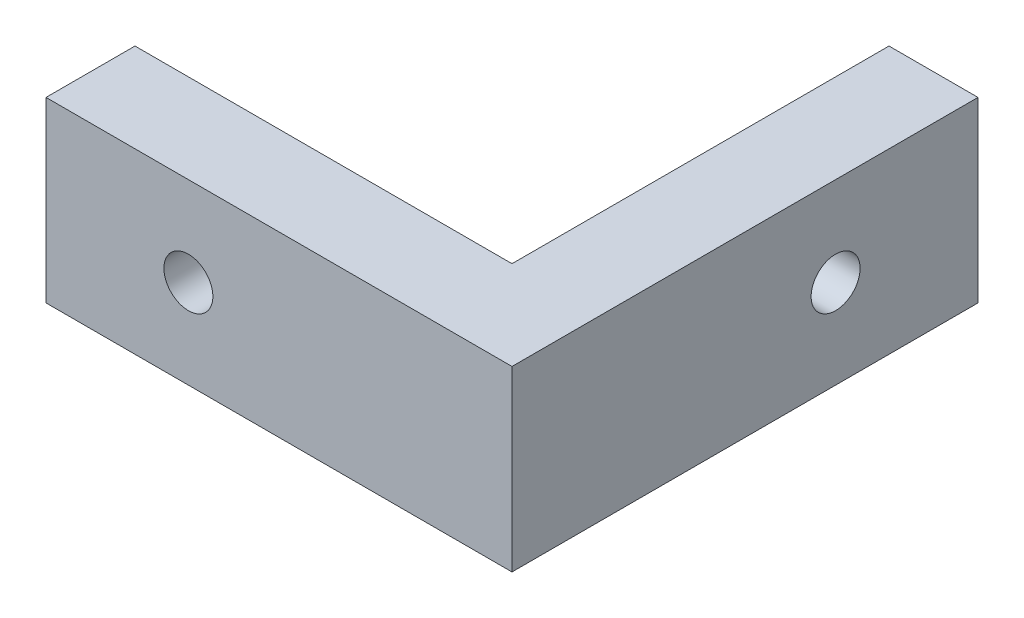
from build123d import *

# Parameters (mm, degrees)
BOSS_EXTRUDE1_DEPTH = 10
CUT_EXTRUDE2_REACH  = 40.351
SKETCH3_R           = 1.375
CUT_EXTRUDE3_REACH  = 40.351
SKETCH4_R           = 1.375


with BuildPart() as part:
    # Sketch2 → Boss-Extrude1 (new body)
    with BuildSketch(Plane(origin=(0, 0, 0), x_dir=(1, 0, 0), z_dir=(0, 1, 0))):
        Polygon((0, 0), (-26.18, 0), (-26.18, 5), (-5, 5), (-5, 26.18), (0, 26.18), align=None)
    extrude(amount=BOSS_EXTRUDE1_DEPTH)

    # Sketch3 → Cut-Extrude2 (cut, up to next)
    with BuildSketch(Plane.XY, mode=Mode.PRIVATE) as cut_extrude2_sk1:
        with Locations((-18.18, 5)):
            Circle(SKETCH3_R)
    cut_extrude2_tool1 = extrude(cut_extrude2_sk1.sketch, amount=-CUT_EXTRUDE2_REACH, mode=Mode.PRIVATE) & part.part
    add(cut_extrude2_tool1.solids().sort_by_distance((-18.18, 5, 0))[0], mode=Mode.SUBTRACT)

    # Sketch4 → Cut-Extrude3 (cut, up to next)
    with BuildSketch(Plane(origin=(0, 0, 0), x_dir=(0, 0, -1), z_dir=(1, 0, 0)), mode=Mode.PRIVATE) as cut_extrude3_sk1:
        with Locations((18.18, 5)):
            Circle(SKETCH4_R)
    cut_extrude3_tool1 = extrude(cut_extrude3_sk1.sketch, amount=-CUT_EXTRUDE3_REACH, mode=Mode.PRIVATE) & part.part
    add(cut_extrude3_tool1.solids().sort_by_distance((0, 5, -18.18))[0], mode=Mode.SUBTRACT)


solid = part.part
